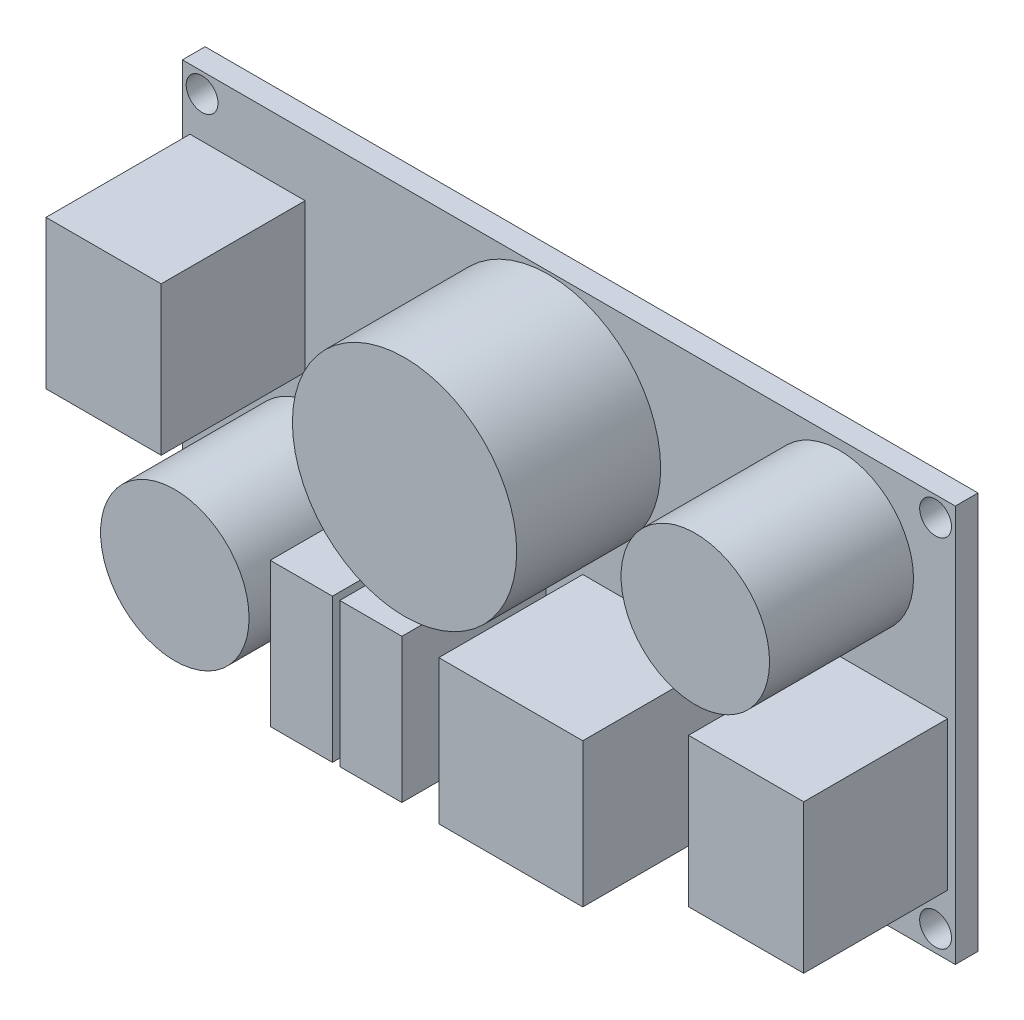
from build123d import *

# Parameters (mm, degrees)
SKETCH_1_W          = 51
SKETCH_1_H          = 26.2
EXTRUDE_1_DEPTH     = 1.5
SKETCH_2_R          = 4.9
SKETCH_2_R_2        = 7.4
SKETCH_2_W          = 7.6
SKETCH_2_H          = 9.8
SKETCH_2_W_2        = 4.1
SKETCH_2_H_2        = 9.5
SKETCH_2_W_3        = 9.5
EXTRUDE_2_DEPTH     = 9.5
SKETCH_3_R          = 1.05
CUT_EXTRUDE_2_DEPTH = 31.201158918


with BuildPart() as part:
    # Эскиз1 → Бобышка-Вытянуть1 (new body)
    with BuildSketch(Plane.XY):
        Rectangle(SKETCH_1_W, SKETCH_1_H)
    extrude(amount=EXTRUDE_1_DEPTH)

    # Эскиз2 → Бобышка-Вытянуть2 (add)
    with BuildSketch(Plane.XY.offset(1.5)):
        with Locations((17.845463421, 7.569209816)):
            Circle(SKETCH_2_R)
        with Locations((-1.340380905, 5.519215491)):
            Circle(SKETCH_2_R_2)
        with Locations((-16.5, -7.1)):
            Circle(SKETCH_2_R)
        with Locations((-21.2, 4.2)):
            Rectangle(SKETCH_2_W, SKETCH_2_H)
        with Locations((21.2, -4.2)):
            Rectangle(SKETCH_2_W, SKETCH_2_H)
        with Locations((-8.15, -7.85)):
            Rectangle(SKETCH_2_W_2, SKETCH_2_H_2)
        with Locations((-3.565582746, -7.85)):
            Rectangle(SKETCH_2_W_2, SKETCH_2_H_2)
        with Locations((5.669869249, -7.851273466)):
            Rectangle(SKETCH_2_W_3, SKETCH_2_H_2)
    extrude(amount=EXTRUDE_2_DEPTH)

    # Эскиз3 → Вырез-Вытянуть2 (cut, through all)
    with BuildSketch(Plane.XY.offset(1.5)):
        with Locations((-24.200212884, 11.79290343)):
            Circle(SKETCH_3_R)
        with Locations((24.199787116, 11.79290343)):
            Circle(SKETCH_3_R)
        with Locations((24.199787116, -11.70709657)):
            Circle(SKETCH_3_R)
        with Locations((-24.200212884, -11.70709657)):
            Circle(SKETCH_3_R)
    extrude(amount=-CUT_EXTRUDE_2_DEPTH, mode=Mode.SUBTRACT)


solid = part.part
